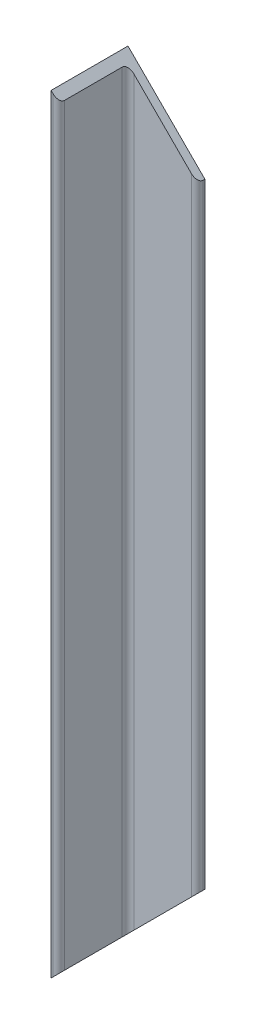
from build123d import *

# Parameters (mm, degrees)
BOSS_EXTRUDE1_DEPTH     = 400
CUT_EXTRUDE1_DEPTH      = 408.622659747
CUT_EXTRUDE1_DEPTH_BACK = 408.622659747


with BuildPart() as part:
    # Sketch1 → Boss-Extrude1 (new body)
    with BuildSketch(Plane(origin=(0, 0, 0), x_dir=(1, 0, 0), z_dir=(0, 1, 0))):
        with BuildLine():
            Line((-27.499872145, 29.213153277), (-67.499872145, 29.213153277))
            Line((-67.499872145, 29.213153277), (-67.499872145, -10.786846723))
            Line((-67.499872145, -10.786846723), (-66.499872145, -10.786846723))
            ThreePointArc((-66.499872145, -10.786846723), (-64.378551801, -9.908167067), (-63.499872145, -7.786846723))
            Line((-63.499872145, -7.786846723), (-63.499872145, 22.213153277))
            ThreePointArc((-63.499872145, 22.213153277), (-62.621192489, 24.334473621), (-60.499872145, 25.213153277))
            Line((-60.499872145, 25.213153277), (-30.499872145, 25.213153277))
            ThreePointArc((-30.499872145, 25.213153277), (-28.378551801, 26.091832933), (-27.499872145, 28.213153277))
            Line((-27.499872145, 28.213153277), (-27.499872145, 29.213153277))
        make_face()
    extrude(amount=BOSS_EXTRUDE1_DEPTH)

    # Sketch2 → Cut-Extrude1 (cut, two sides: drawn at the far end of the back side and taken through both)
    with BuildSketch(Plane(origin=(0, 0, -29.213153277), x_dir=(-1, 0, 0), z_dir=(0, 0, -1)).offset(-CUT_EXTRUDE1_DEPTH_BACK)):
        Polygon((67.499872145, 0), (27.499872145, 40), (27.499872145, 0), align=None)
        Polygon((27.499872145, 400), (67.499872145, 400), (27.499872145, 360), align=None)
    extrude(amount=CUT_EXTRUDE1_DEPTH + CUT_EXTRUDE1_DEPTH_BACK, mode=Mode.SUBTRACT)


solid = part.part
